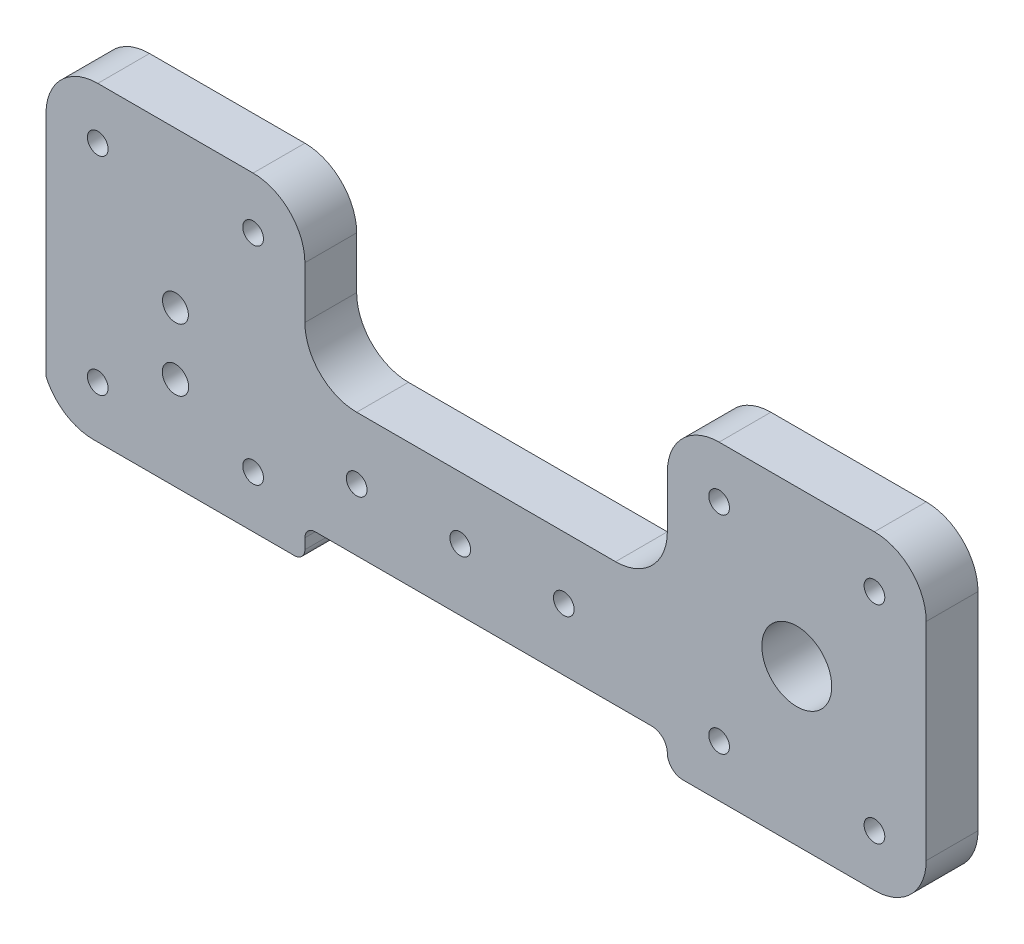
from build123d import *

# Parameters (mm, degrees)
MODEL_R             = 2
MODEL_R_2           = 2.5
MODEL_R_3           = 6.75
MODEL_R_4           = 2.55
BOSS_EXTRUDE1_DEPTH = 10


with BuildPart() as part:
    # Model → Boss-Extrude1 (new body)
    with BuildSketch(Plane.XY):
        with BuildLine():
            Line((-13.089430894, 50), (-13.089430894, 6))
            ThreePointArc((-13.089430894, 6), (-9.401505079, 1.633399735), (-3.924279504, 0))
            Line((-3.924279504, 0), (34.910569106, 0))
            ThreePointArc((34.910569106, 0), (36.324782668, 0.585786438), (36.910569106, 2))
            Line((36.910569106, 2), (36.910569106, 4))
            ThreePointArc((36.910569106, 4), (37.496355543, 5.414213562), (38.910569106, 6))
            Line((38.910569106, 6), (103.910569106, 6))
            ThreePointArc((103.910569106, 6), (106.031889449, 5.121320344), (106.910569106, 3))
            ThreePointArc((106.910569106, 3), (107.789248762, 0.878679656), (109.910569106, 0))
            Line((109.910569106, 0), (146.910569106, 0))
            ThreePointArc((146.910569106, 0), (153.981636918, 2.928932188), (156.910569106, 10))
            Line((156.910569106, 10), (156.910569106, 50))
            ThreePointArc((156.910569106, 50), (153.981636918, 57.071067812), (146.910569106, 60))
            Line((146.910569106, 60), (116.910569106, 60))
            ThreePointArc((116.910569106, 60), (109.839501294, 57.071067812), (106.910569106, 50))
            Line((106.910569106, 50), (106.910569106, 40))
            ThreePointArc((106.910569106, 40), (103.981636918, 32.928932188), (96.910569106, 30))
            Line((96.910569106, 30), (46.910569106, 30))
            ThreePointArc((46.910569106, 30), (39.839501294, 32.928932188), (36.910569106, 40))
            Line((36.910569106, 40), (36.910569106, 50))
            ThreePointArc((36.910569106, 50), (33.981636918, 57.071067812), (26.910569106, 60))
            Line((26.910569106, 60), (-3.089430894, 60))
            ThreePointArc((-3.089430894, 60), (-10.160498706, 57.071067812), (-13.089430894, 50))
        make_face()
        with Locations((26.910569106, 50)):
            Circle(MODEL_R, mode=Mode.SUBTRACT)
        with Locations((26.910569106, 10)):
            Circle(MODEL_R, mode=Mode.SUBTRACT)
        with Locations((11.910569106, 30)):
            Circle(MODEL_R_2, mode=Mode.SUBTRACT)
        with Locations((131.910569106, 30)):
            Circle(MODEL_R_3, mode=Mode.SUBTRACT)
        with Locations((146.910569106, 50)):
            Circle(MODEL_R, mode=Mode.SUBTRACT)
        with Locations((86.910569106, 18)):
            Circle(MODEL_R, mode=Mode.SUBTRACT)
        with Locations((146.910569106, 10)):
            Circle(MODEL_R, mode=Mode.SUBTRACT)
        with Locations((116.910569106, 10)):
            Circle(MODEL_R, mode=Mode.SUBTRACT)
        with Locations((46.910569106, 18)):
            Circle(MODEL_R, mode=Mode.SUBTRACT)
        with Locations((66.910569106, 18)):
            Circle(MODEL_R, mode=Mode.SUBTRACT)
        with Locations((116.910569106, 50)):
            Circle(MODEL_R, mode=Mode.SUBTRACT)
        with Locations((11.910569106, 18)):
            Circle(MODEL_R_4, mode=Mode.SUBTRACT)
        with Locations((-3.089430894, 10)):
            Circle(MODEL_R, mode=Mode.SUBTRACT)
        with Locations((-3.089430894, 50)):
            Circle(MODEL_R, mode=Mode.SUBTRACT)
    extrude(amount=BOSS_EXTRUDE1_DEPTH)


solid = part.part
